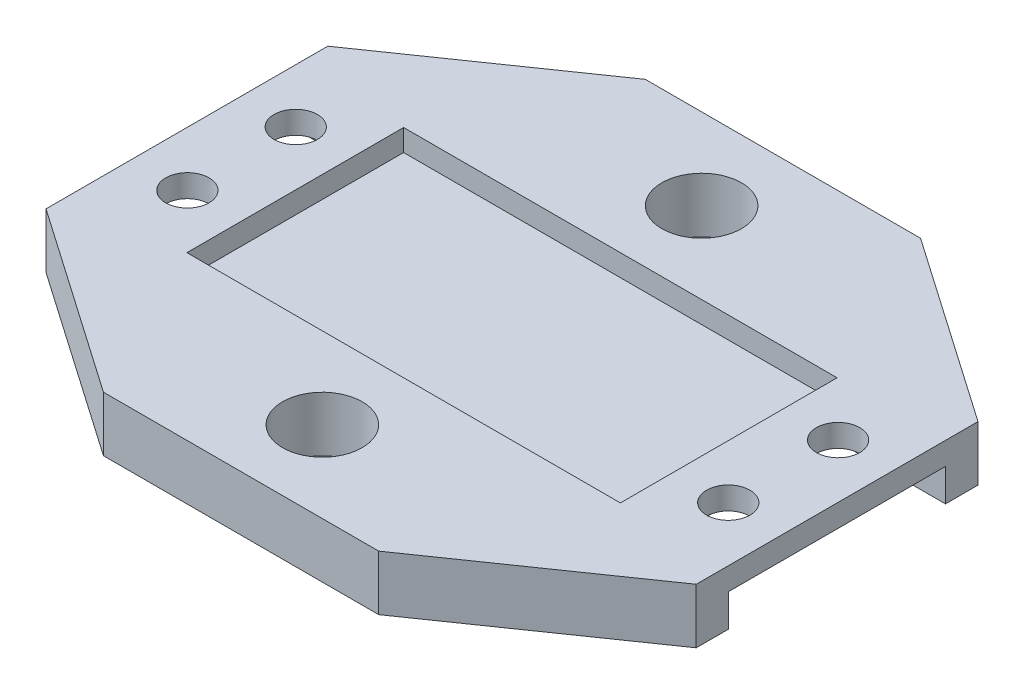
from build123d import *

# Parameters (mm, degrees)
SKETCH1_W           = 60
SKETCH1_H           = 50
BOSS_EXTRUDE1_DEPTH = 5.08
SKETCH2_OUTSIDE_W   = 77.654
SKETCH2_OUTSIDE_H   = 67.654
SKETCH2_OUTSIDE_R   = 3.675
CUT_EXTRUDE1_DEPTH  = 56.468381585
SKETCH12_W          = 20
SKETCH12_H          = 3
CUT_EXTRUDE6_DEPTH  = 10
SKETCH13_W          = 20
SKETCH13_H          = 3
CUT_EXTRUDE7_DEPTH  = 10
SKETCH14_W          = 40
SKETCH14_H          = 20
CUT_EXTRUDE8_DEPTH  = 2
SKETCH15_R          = 2
CUT_EXTRUDE9_DEPTH  = 56.468381585


with BuildPart() as part:
    # Sketch1 → Boss-Extrude1 (new body)
    with BuildSketch(Plane(origin=(0, 0, 0), x_dir=(1, 0, 0), z_dir=(0, 1, 0))):
        with Locations((-18.058684047, 2.226785401)):
            Rectangle(SKETCH1_W, SKETCH1_H)
    extrude(amount=BOSS_EXTRUDE1_DEPTH)

    # Sketch2 outside → Cut-Extrude1 (cut, through all)
    # profile 1 of 3: a face of its own
    with BuildSketch(Plane(origin=(0, 5.08, 0), x_dir=(1, 0, 0), z_dir=(0, 1, 0))):
        with Locations((-18.059, 2.227)):
            Rectangle(SKETCH2_OUTSIDE_W, SKETCH2_OUTSIDE_H)
        Polygon((-30.758684047, 27.226785401), (-5.358684047, 27.226785401), (11.941315953, 15.226785401), (11.941315953, -10.773214599), (-5.358684047, -22.773214599), (-30.758684047, -22.773214599), (-48.058684047, -10.773214599), (-48.058684047, 15.226785401), align=None, mode=Mode.SUBTRACT)
    # profile 2 of 3: a face of its own
    with BuildSketch(Plane(origin=(0, 5.08, 0), x_dir=(1, 0, 0), z_dir=(0, 1, 0))):
        with Locations(Location((-18.058684047, 19.726785401, 0), (0, 0, 270))):
            Circle(SKETCH2_OUTSIDE_R)
    # profile 3 of 3: a face of its own
    with BuildSketch(Plane(origin=(0, 5.08, 0), x_dir=(1, 0, 0), z_dir=(0, 1, 0))):
        with Locations(Location((-18.058684047, -15.273214599, 0), (0, 0, 90))):
            Circle(SKETCH2_OUTSIDE_R)
    extrude(amount=-CUT_EXTRUDE1_DEPTH, mode=Mode.SUBTRACT)

    # Sketch12 → Cut-Extrude6 (cut)
    with BuildSketch(Plane.ZY.offset(48.058684047)):
        with Locations((-2.185006669, 1.5)):
            Rectangle(SKETCH12_W, SKETCH12_H)
    extrude(amount=-CUT_EXTRUDE6_DEPTH, mode=Mode.SUBTRACT)

    # Sketch13 → Cut-Extrude7 (cut)
    with BuildSketch(Plane(origin=(11.941315953, 0, 0), x_dir=(0, 0, -1), z_dir=(1, 0, 0))):
        with Locations((2.226785401, 1.5)):
            Rectangle(SKETCH13_W, SKETCH13_H)
    extrude(amount=-CUT_EXTRUDE7_DEPTH, mode=Mode.SUBTRACT)

    # Sketch14 → Cut-Extrude8 (cut)
    with BuildSketch(Plane(origin=(0, 5.08, 0), x_dir=(1, 0, 0), z_dir=(0, 1, 0))):
        with Locations((-18.058684047, 2.226785401)):
            Rectangle(SKETCH14_W, SKETCH14_H)
    extrude(amount=-CUT_EXTRUDE8_DEPTH, mode=Mode.SUBTRACT)

    # Sketch15 → Cut-Extrude9 (cut, through all)
    with BuildSketch(Plane(origin=(0, 5.08, 0), x_dir=(1, 0, 0), z_dir=(0, 1, 0))):
        with Locations(Location((-43.015186805, -2.773214599, 0), (0, 0, 270))):
            Circle(SKETCH15_R)
        with Locations(Location((-43.081568636, 7.292867381, 0), (0, 0, 270))):
            Circle(SKETCH15_R)
        with Locations(Location((6.964200542, 7.292867381, 0), (0, 0, 270))):
            Circle(SKETCH15_R)
        with Locations(Location((6.89781871, -2.773214599, 0), (0, 0, 270))):
            Circle(SKETCH15_R)
    extrude(amount=-CUT_EXTRUDE9_DEPTH, mode=Mode.SUBTRACT)


solid = part.part
